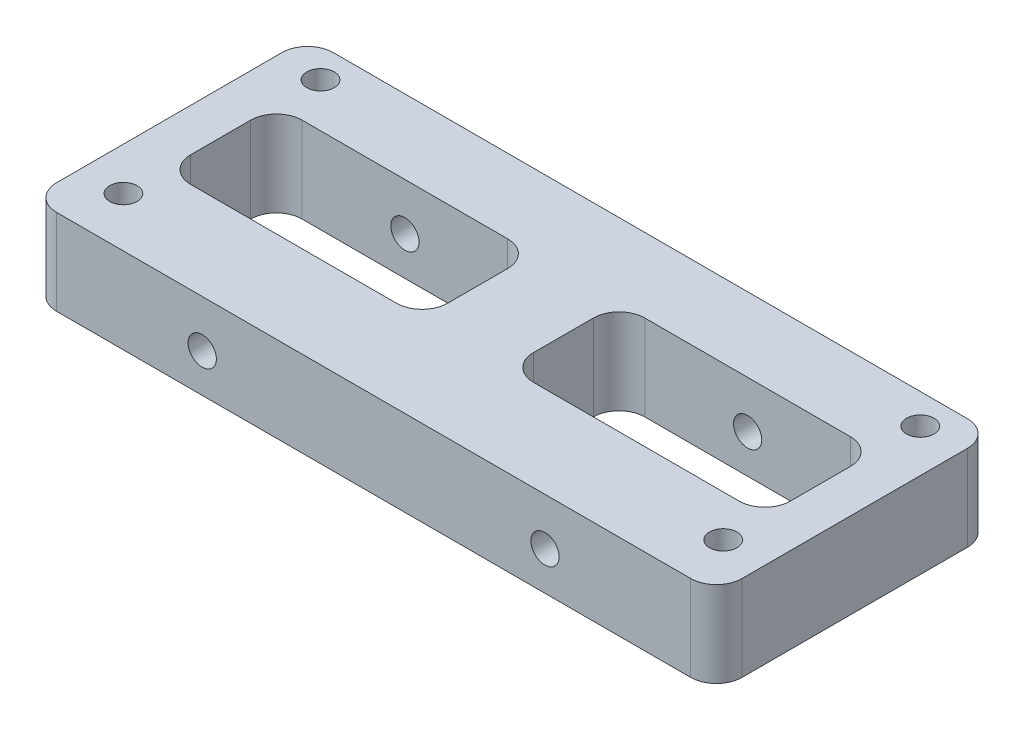
from build123d import *

# Parameters (mm, degrees)
SKETCH_1_R          = 1.6
SKETCH_1_W          = 30
SKETCH_1_H          = 13
EXTRUDE_1_DEPTH     = 10
SKETCH_2_R          = 1.65
CUT_EXTRUDE_1_DEPTH = 54.632918996
SKETCH_4_R          = 3
CUT_EXTRUDE_3_DEPTH = 5
SKETCH_6_W          = 80
SKETCH_6_H          = 2
CUT_EXTRUDE_5_DEPTH = 45.655598753
FILLET_1_R          = 3


with BuildPart() as part:
    # 草图1 → 凸台-拉伸1 (new body)
    with BuildSketch(Plane(origin=(0, 0, 0), x_dir=(1, 0, 0), z_dir=(0, 1, 0))):
        Polygon((-40, -17.15), (-40, 17.15), (40, 17.15), (40, -17.15), (20, -17.15), (-20, -17.15), align=None)
        with Locations(Location((-35, 11.65, 0), (0, 0, 270))):
            Circle(SKETCH_1_R, mode=Mode.SUBTRACT)
        with Locations(Location((-35, -11.35, 0), (0, 0, 270))):
            Circle(SKETCH_1_R, mode=Mode.SUBTRACT)
        with Locations(Location((35, -11.35, 0), (0, 0, 90))):
            Circle(SKETCH_1_R, mode=Mode.SUBTRACT)
        with Locations(Location((35, 11.65, 0), (0, 0, 90))):
            Circle(SKETCH_1_R, mode=Mode.SUBTRACT)
        with Locations((-20, 0)):
            Rectangle(SKETCH_1_W, SKETCH_1_H, mode=Mode.SUBTRACT)
        with Locations((20, 0)):
            Rectangle(SKETCH_1_W, SKETCH_1_H, mode=Mode.SUBTRACT)
    extrude(amount=EXTRUDE_1_DEPTH)

    # 草图2 → 切除-拉伸1 (cut, through all)
    with BuildSketch(Plane(origin=(0, 0, -17.15), x_dir=(-1, 0, 0), z_dir=(0, 0, -1))):
        with Locations((-20, 4.5)):
            Circle(SKETCH_2_R)
        with Locations(Location((20, 4.5, 0), (0, 0, 180))):
            Circle(SKETCH_2_R)
    extrude(amount=-CUT_EXTRUDE_1_DEPTH, mode=Mode.SUBTRACT)

    # 草图4 → 切除-拉伸3 (cut)
    with BuildSketch(Plane(origin=(0, 0, -17.15), x_dir=(-1, 0, 0), z_dir=(0, 0, -1))):
        with Locations((-20, 4.5)):
            Circle(SKETCH_4_R)
        with Locations(Location((20, 4.5, 0), (0, 0, 180))):
            Circle(SKETCH_4_R)
    extrude(amount=-CUT_EXTRUDE_3_DEPTH, mode=Mode.SUBTRACT)

    # 草图6 → 切除-拉伸5 (cut, through all)
    with BuildSketch(Plane(origin=(0, 10, 0), x_dir=(1, 0, 0), z_dir=(0, 1, 0))):
        with Locations((0, 16.15)):
            Rectangle(SKETCH_6_W, SKETCH_6_H)
    extrude(amount=-CUT_EXTRUDE_5_DEPTH, mode=Mode.SUBTRACT)

    # 圆角1
    fillet_1_edges = [part.edges().sort_by_distance(p)[0] for p in [
        (40, 5, -15.15),
        (-40, 5, -15.15),
        (40, 5, 17.15),
        (-40, 5, 17.15),
        (-35, 5, -6.5),
        (-35, 5, 6.5),
        (-5, 5, 6.5),
        (-5, 5, -6.5),
        (35, 5, -6.5),
        (5, 5, -6.5),
        (5, 5, 6.5),
        (35, 5, 6.5),
    ]]
    fillet(fillet_1_edges, radius=FILLET_1_R)


solid = part.part
